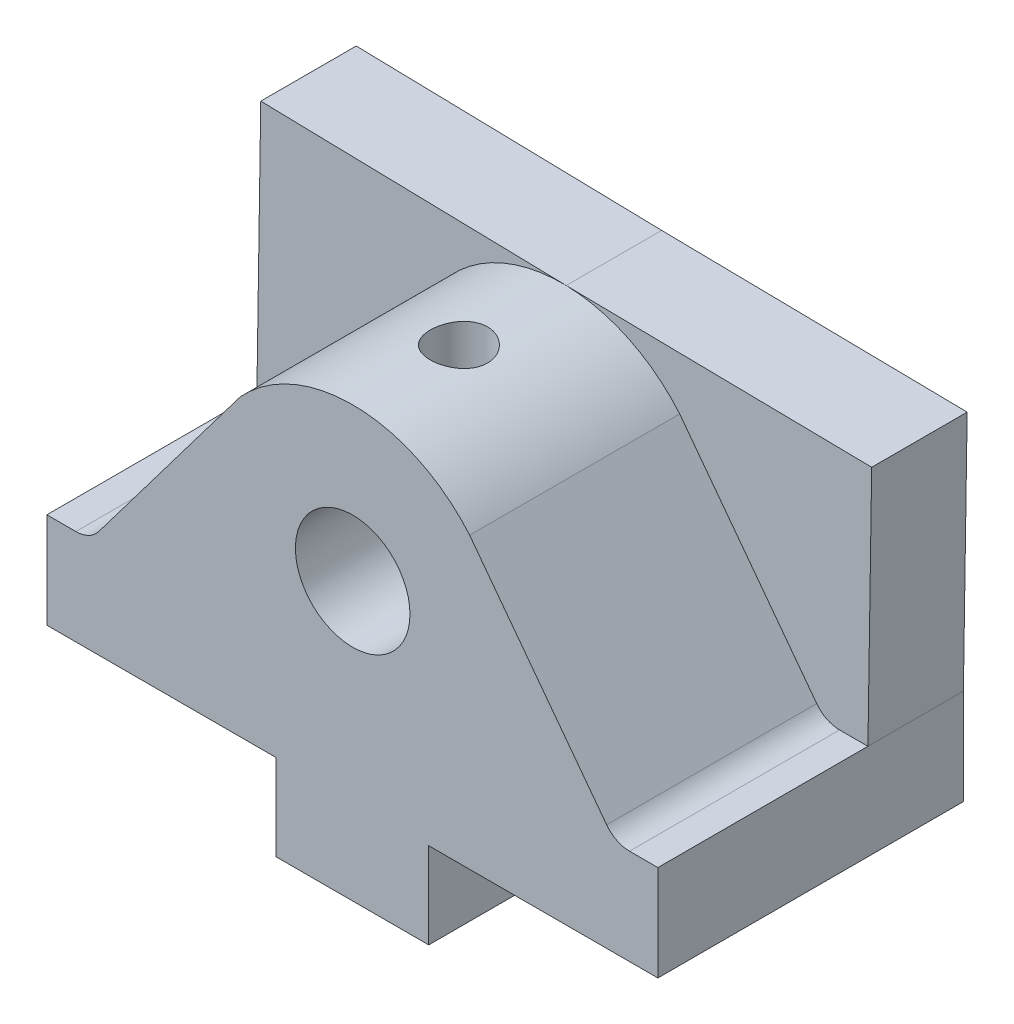
from build123d import *

# Parameters (mm, degrees)
SKETCH1_R           = 6
BOSS_EXTRUDE1_DEPTH = 22
SKETCH3_R           = 3
CUT_EXTRUDE2_DEPTH  = 22
SKETCH4_R           = 6
BOSS_EXTRUDE2_DEPTH = 10
SKETCH5_R           = 3
CUT_EXTRUDE3_DEPTH  = 16


with BuildPart() as part:
    # Sketch1 → Boss-Extrude1 (new body)
    with BuildSketch(Plane.XY):
        with BuildLine():
            ThreePointArc((12.250598906, 10.291881579), (6.757584433, 14.502932553), (0, 16))
            ThreePointArc((0, 16), (-6.42506456, 14.653277633), (-11.768531852, 10.839818174))
            Line((-11.768531852, 10.839818174), (-13.649705535, 8.347786462))
            Line((-13.649705535, 8.347786462), (-26.599782678, -8.807462524))
            ThreePointArc((-26.599782678, -8.807462524), (-27.656705011, -9.685366602), (-28.994167614, -10))
            Line((-28.994167614, -10), (-32.032992561, -10))
            Line((-32.032992561, -10), (-32.032992561, -20.01649628))
            Line((-32.032992561, -20.01649628), (-27.5, -20.01649628))
            Line((-27.5, -20.01649628), (-8.032992561, -20.01649628))
            Line((-8.032992561, -20.01649628), (-8.032992561, -29.01649628))
            Line((-8.032992561, -29.01649628), (-0.032992561, -29.01649628))
            Line((-0.032992561, -29.01649628), (7.967007439, -29.01649628))
            Line((7.967007439, -29.01649628), (7.967007439, -20.01649628))
            Line((7.967007439, -20.01649628), (27.5, -20.01649628))
            Line((27.5, -20.01649628), (31.967007439, -20.01649628))
            Line((31.967007439, -20.01649628), (31.967007439, -10))
            Line((31.967007439, -10), (28.998198652, -10))
            ThreePointArc((28.998198652, -10), (27.65784727, -9.683925888), (26.599929469, -8.802305447))
            Line((26.599929469, -8.802305447), (13.293285189, 8.904412888))
            Line((13.293285189, 8.904412888), (12.250598906, 10.291881579))
        make_face()
        Circle(SKETCH1_R, mode=Mode.SUBTRACT)
    extrude(amount=-BOSS_EXTRUDE1_DEPTH)

    # Sketch3 → Cut-Extrude2 (cut)
    with BuildSketch(Plane(origin=(0, 0, 0), x_dir=(1, 0, 0), z_dir=(0, 1, 0))):
        with Locations(Location((0, 11.125223176, 0), (0, 0, 90))):
            Circle(SKETCH3_R)
    extrude(amount=CUT_EXTRUDE2_DEPTH, mode=Mode.SUBTRACT)

    # Sketch4 → Boss-Extrude2 (add)
    # profile 1 of 3: a face of its own
    with BuildSketch(Plane(origin=(0, 0, -22), x_dir=(-1, 0, 0), z_dir=(0, 0, -1))):
        with BuildLine():
            ThreePointArc((-12.250598906, 10.291881579), (-6.922536855, 14.424925771), (-0.364905179, 15.99583834))
            Line((-0.364905179, 15.99583834), (-32.361209339, 15.509505054))
            Line((-32.361209339, 15.509505054), (-31.967007439, -10))
            Line((-31.967007439, -10), (-28.998198652, -10))
            ThreePointArc((-28.998198652, -10), (-27.65784727, -9.683925888), (-26.599929469, -8.802305447))
            Line((-26.599929469, -8.802305447), (-12.250598906, 10.291881579))
        make_face()
    # profile 2 of 3: a face of its own
    with BuildSketch(Plane(origin=(0, 0, -22), x_dir=(-1, 0, 0), z_dir=(0, 0, -1))):
        with BuildLine():
            Line((31.626771502, 16.725648698), (-0.364905179, 15.99583834))
            ThreePointArc((-0.364905179, 15.99583834), (6.257540356, 14.725596378), (11.768531852, 10.839818174))
            Line((11.768531852, 10.839818174), (26.599782678, -8.807462524))
            ThreePointArc((26.599782678, -8.807462524), (27.656705011, -9.685366602), (28.994167614, -10))
            Line((28.994167614, -10), (32.032992561, -10))
            Line((32.032992561, -10), (31.626771502, 16.725648698))
        make_face()
    # profile 3 of 3: a face of its own
    with BuildSketch(Plane(origin=(0, 0, -22), x_dir=(-1, 0, 0), z_dir=(0, 0, -1))):
        with BuildLine():
            Line((32.032992561, -10), (28.994167614, -10))
            ThreePointArc((28.994167614, -10), (27.656705011, -9.685366602), (26.599782678, -8.807462524))
            Line((26.599782678, -8.807462524), (11.768531852, 10.839818174))
            ThreePointArc((11.768531852, 10.839818174), (-0.364905179, 15.99583834), (-12.250598906, 10.291881579))
            Line((-12.250598906, 10.291881579), (-26.599929469, -8.802305447))
            ThreePointArc((-26.599929469, -8.802305447), (-27.65784727, -9.683925888), (-28.998198652, -10))
            Line((-28.998198652, -10), (-31.967007439, -10))
            Line((-31.967007439, -10), (-31.967007439, -20.01649628))
            Line((-31.967007439, -20.01649628), (-7.967007439, -20.01649628))
            Line((-7.967007439, -20.01649628), (-7.967007439, -29.01649628))
            Line((-7.967007439, -29.01649628), (8.032992561, -29.01649628))
            Line((8.032992561, -29.01649628), (8.032992561, -20.01649628))
            Line((8.032992561, -20.01649628), (32.032992561, -20.01649628))
            Line((32.032992561, -20.01649628), (32.032992561, -10))
        make_face()
        with Locations(Location((0, 0, 0), (0, 0, 180))):
            Circle(SKETCH4_R, mode=Mode.SUBTRACT)
    extrude(amount=BOSS_EXTRUDE2_DEPTH)

    # Sketch5 → Cut-Extrude3 (cut)
    with BuildSketch(Plane.XZ.offset(29.01649628)):
        with Locations(Location((-0.579448602, -15.423300258, 0), (0, 0, 270))):
            Circle(SKETCH5_R)
    extrude(amount=-CUT_EXTRUDE3_DEPTH, mode=Mode.SUBTRACT)


solid = part.part
